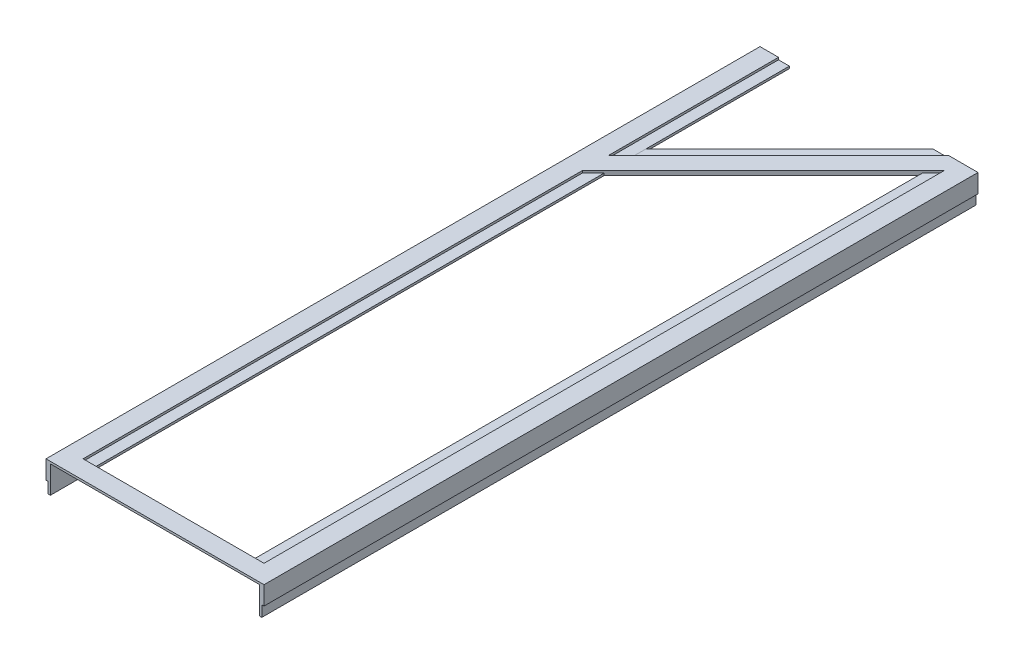
from build123d import *

# Parameters (mm, degrees)
BOSS_EXTRUDE1_DEPTH   = 327.5
BOSS_EXTRUDE1_2_DEPTH = 327.5
BOSS_EXTRUDE2_DEPTH   = 2
BOSS_EXTRUDE4_DEPTH   = 1
SKETCH4_W             = 100
SKETCH4_H             = 8.5
BOSS_EXTRUDE5_DEPTH   = 2
BOSS_EXTRUDE6_DEPTH   = 1
SKETCH7_R             = 5
SKETCH7_W             = 96
SKETCH7_H             = 1
CUT_EXTRUDE2_DEPTH    = 1
SKETCH8_W             = 100
SKETCH8_H             = 13.5
CUT_EXTRUDE3_DEPTH    = 400
SKETCH9_W             = 1
SKETCH9_H             = 5
CUT_EXTRUDE4_DEPTH    = 84.5


with BuildPart() as part:
    # Sketch1 → Boss-Extrude1 (new body)
    with BuildSketch(Plane.XY):
        Polygon((0, 0), (0, 8.5), (1, 8.5), (1, 13.5), (2, 13.5), (2, 2), (13.5, 2), (13.5, 1), (8.5, 1), (8.5, 0), align=None)
    extrude(amount=BOSS_EXTRUDE1_DEPTH)



with BuildPart() as body_2:
    # Sketch1 → Boss-Extrude1 2 (new body)
    with BuildSketch(Plane.XY):
        Polygon((100, 0), (91.5, 0), (91.5, 1), (86.5, 1), (86.5, 2), (98, 2), (98, 13.5), (99, 13.5), (99, 8.5), (100, 8.5), align=None)
    extrude(amount=BOSS_EXTRUDE1_2_DEPTH)


with BuildPart() as part_1:
    add(part.part)

    add(body_2.part)  # Boss-Extrude2 merges body 2
    # Sketch2 → Boss-Extrude2 (add)
    with BuildSketch(Plane(origin=(0, 2, 0), x_dir=(1, 0, 0), z_dir=(0, 1, 0))):
        Polygon((86.5, 0), (13.5, -73), (13.5, -85.02081528), (86.5, -12.02081528), align=None)
    extrude(amount=-BOSS_EXTRUDE2_DEPTH)

    # Sketch3 → Boss-Extrude4 (add)
    with BuildSketch(Plane.XZ.offset(-1)):
        Polygon((13.5, 73), (13.5, 85.02081528), (8.5, 90.02081528), (8.5, 78), align=None)
        Polygon((86.5, 0), (86.5, 12.02081528), (91.5, 7.02081528), (91.5, 0), align=None)
    extrude(amount=BOSS_EXTRUDE4_DEPTH)

    # Sketch4 → Boss-Extrude5 (add)
    with BuildSketch(Plane.XZ):
        with Locations((50, 323.25)):
            Rectangle(SKETCH4_W, SKETCH4_H)
    extrude(amount=-BOSS_EXTRUDE5_DEPTH)

    # Sketch7 → Cut-Extrude2 (cut)
    with BuildSketch(Plane(origin=(0, 2, 0), x_dir=(1, 0, 0), z_dir=(0, 1, 0))):
        with Locations((26.5, -326.5)):
            Circle(SKETCH7_R)
        with Locations((73.5, -326.5)):
            Circle(SKETCH7_R)
        with Locations((50, -327)):
            Rectangle(SKETCH7_W, SKETCH7_H)
    extrude(amount=-CUT_EXTRUDE2_DEPTH, mode=Mode.SUBTRACT)


with BuildPart() as body_2_2:
    # Sketch5 → Boss-Extrude6 (new body)
    with BuildSketch(Plane(origin=(0, 2, 0), x_dir=(1, 0, 0), z_dir=(0, 1, 0))):
        Polygon((13.5, -65.928932188), (79.428932188, 0), (86.5, 0), (13.5, -73), align=None)
    extrude(amount=-BOSS_EXTRUDE6_DEPTH)


with BuildPart() as body_3:
    # Mirror1: mirrored copy
    add(body_2_2.part.mirror(Plane(origin=(1, 13.5, 327.5), x_dir=(0, 0, 1), z_dir=(0, -1, 0))))


with BuildPart() as body_4:
    # Mirror1 2: mirrored copy
    add(part_1.part.mirror(Plane(origin=(1, 13.5, 327.5), x_dir=(0, 0, 1), z_dir=(0, -1, 0))))

    # Sketch9 → Cut-Extrude4 (cut)
    with BuildSketch(Plane(origin=(0, 0, 0), x_dir=(-1, 0, 0), z_dir=(0, 0, -1))):
        with Locations((-1.5, 16)):
            Rectangle(SKETCH9_W, SKETCH9_H)
    extrude(amount=-CUT_EXTRUDE4_DEPTH, mode=Mode.SUBTRACT)


with BuildPart() as cut_extrude3_tool:
    # Sketch8 → Cut-Extrude3 (new body)
    with BuildSketch(Plane(origin=(0, 0, 0), x_dir=(-1, 0, 0), z_dir=(0, 0, -1))):
        with Locations((-50, 6.75)):
            Rectangle(SKETCH8_W, SKETCH8_H)
    extrude(amount=-CUT_EXTRUDE3_DEPTH)


with BuildPart() as part_2:
    add(part_1.part)

    # Cut-Extrude3: cut by cut_extrude3_tool
    add(cut_extrude3_tool.part, mode=Mode.SUBTRACT)


with BuildPart() as body_2_2_1:
    add(body_2_2.part)

    # Cut-Extrude3: cut by cut_extrude3_tool
    add(cut_extrude3_tool.part, mode=Mode.SUBTRACT)


solid = Compound([body_3.part, body_4.part])
